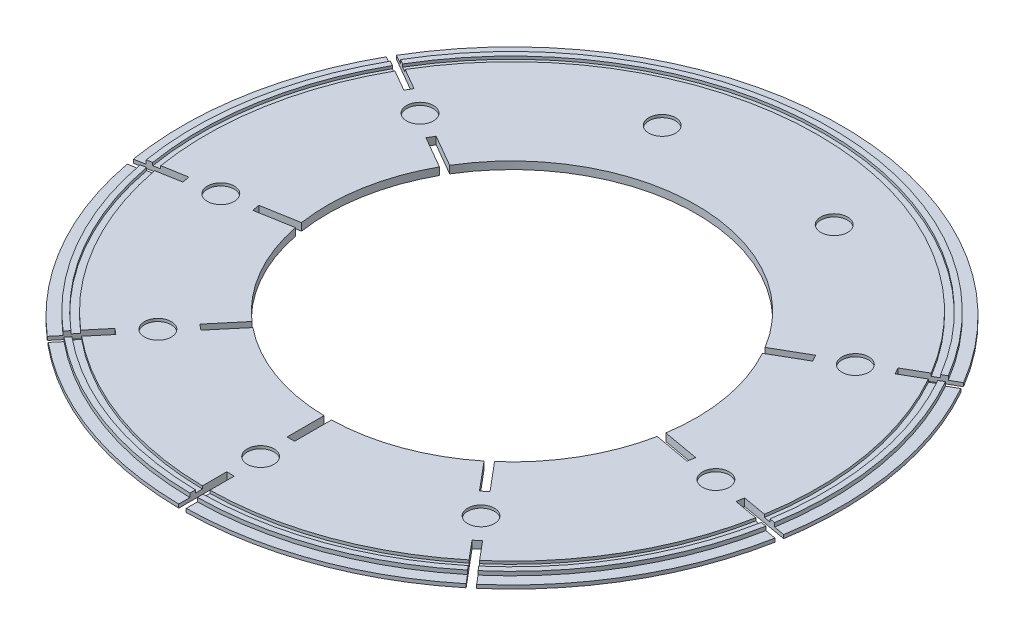
from build123d import *

# Parameters (mm, degrees)
SKETCH1_R           = 295
SKETCH1_R_2         = 165
BOSS_EXTRUDE1_DEPTH = 6.7
SKETCH2_W           = 6.7
SKETCH2_H           = 34
SKETCH2_H_2         = 44
CUT_EXTRUDE3_DEPTH  = 6.7
SKETCH3_R           = 280
SKETCH3_R_2         = 273.8
SKETCH3_R_3         = 12
CUT_EXTRUDE4_DEPTH  = 2.5
SKETCH5_R           = 296
SKETCH5_R_2         = 285
CUT_EXTRUDE5_DEPTH  = 3.5


with BuildPart() as part:
    # Sketch1 → Boss-Extrude1 (new body)
    with BuildSketch(Plane(origin=(0, 0, 0), x_dir=(1, 0, 0), z_dir=(0, 1, 0))):
        with Locations(Location((0, 0, 0), (0, 0, 270))):
            Circle(SKETCH1_R)
        with Locations(Location((0, 0, 0), (0, 0, 270))):
            Circle(SKETCH1_R_2, mode=Mode.SUBTRACT)
    extrude(amount=BOSS_EXTRUDE1_DEPTH)

    # Sketch2 → Cut-Extrude3 (cut)
    with BuildSketch(Plane(origin=(0, 6.7, 0), x_dir=(1, 0, 0), z_dir=(0, 1, 0))):
        Polygon((254.66851952, 150.901185103), (216.563401754, 128.901185103), (219.913401754, 123.098814897), (258.01851952, 145.098814897), align=None)
        Polygon((169.798029949, 101.901185103), (140.353166221, 84.901185103), (143.703166221, 79.098814897), (173.148029949, 96.098814897), align=None)
        Polygon((129.838195602, -149.523461245), (107.983416873, -123.477950179), (102.850919104, -127.784627164), (124.705697833, -153.83013823), align=None)
        Polygon((290.921373496, -54.698966562), (292.084816287, -48.100754617), (248.753275154, -40.460234799), (247.589832364, -47.058446745), align=None)
        Polygon((195.573656492, -31.083233205), (162.090192889, -25.179195165), (160.926750099, -31.77740711), (194.410213701, -37.681445151), align=None)
        Polygon((187.698883583, -228.902493656), (192.831381352, -224.595816671), (164.548726525, -190.889861174), (159.416228757, -195.196538158), align=None)
        with Locations((0, -181)):
            Rectangle(SKETCH2_W, SKETCH2_H)
        with Locations((0, -274)):
            Rectangle(SKETCH2_W, SKETCH2_H_2)
        Polygon((-124.705697833, -153.83013823), (-102.850919104, -127.784627164), (-107.983416873, -123.477950179), (-129.838195602, -149.523461245), align=None)
        Polygon((-192.831381352, -224.595816671), (-187.698883583, -228.902493656), (-159.416228757, -195.196538158), (-164.548726525, -190.889861174), align=None)
        Polygon((-194.410213701, -37.681445151), (-160.926750099, -31.77740711), (-162.090192889, -25.179195165), (-195.573656492, -31.083233205), align=None)
        Polygon((-292.084816287, -48.100754617), (-290.921373496, -54.698966562), (-247.589832364, -47.058446745), (-248.753275154, -40.460234799), align=None)
        Polygon((-254.66851952, 150.901185103), (-258.01851952, 145.098814897), (-219.913401754, 123.098814897), (-216.563401754, 128.901185103), align=None)
        Polygon((-173.148029949, 96.098814897), (-143.703166221, 79.098814897), (-140.353166221, 84.901185103), (-169.798029949, 101.901185103), align=None)
    extrude(amount=-CUT_EXTRUDE3_DEPTH, mode=Mode.SUBTRACT)

    # Sketch3 → Cut-Extrude4 (cut)
    # profile 1 of 10: a face of its own
    with BuildSketch(Plane(origin=(0, 6.7, 0), x_dir=(1, 0, 0), z_dir=(0, 1, 0))):
        Circle(SKETCH3_R)
        Circle(SKETCH3_R_2, mode=Mode.SUBTRACT)
    # profile 2 of 10: a face of its own
    with BuildSketch(Plane(origin=(0, 6.7, 0), x_dir=(1, 0, 0), z_dir=(0, 1, 0))):
        with Locations(Location((0, -225, 0), (0, 0, 270))):
            Circle(SKETCH3_R_3)
    # profile 3 of 10: a face of its own
    with BuildSketch(Plane(origin=(0, 6.7, 0), x_dir=(1, 0, 0), z_dir=(0, 1, 0))):
        with Locations(Location((-144.627212179, -172.359999702, 0), (0, 0, 270))):
            Circle(SKETCH3_R_3)
    # profile 4 of 10: a face of its own
    with BuildSketch(Plane(origin=(0, 6.7, 0), x_dir=(1, 0, 0), z_dir=(0, 1, 0))):
        with Locations(Location((-221.581744428, -39.070839975, 0), (0, 0, 270))):
            Circle(SKETCH3_R_3)
    # profile 5 of 10: a face of its own
    with BuildSketch(Plane(origin=(0, 6.7, 0), x_dir=(1, 0, 0), z_dir=(0, 1, 0))):
        with Locations(Location((-194.855715851, 112.5, 0), (0, 0, 270))):
            Circle(SKETCH3_R_3)
    # profile 6 of 10: a face of its own
    with BuildSketch(Plane(origin=(0, 6.7, 0), x_dir=(1, 0, 0), z_dir=(0, 1, 0))):
        with Locations(Location((-76.954532248, 211.430839677, 0), (0, 0, 270))):
            Circle(SKETCH3_R_3)
    # profile 7 of 10: a face of its own
    with BuildSketch(Plane(origin=(0, 6.7, 0), x_dir=(1, 0, 0), z_dir=(0, 1, 0))):
        with Locations(Location((76.954532248, 211.430839677, 0), (0, 0, 270))):
            Circle(SKETCH3_R_3)
    # profile 8 of 10: a face of its own
    with BuildSketch(Plane(origin=(0, 6.7, 0), x_dir=(1, 0, 0), z_dir=(0, 1, 0))):
        with Locations(Location((194.855715851, 112.5, 0), (0, 0, 270))):
            Circle(SKETCH3_R_3)
    # profile 9 of 10: a face of its own
    with BuildSketch(Plane(origin=(0, 6.7, 0), x_dir=(1, 0, 0), z_dir=(0, 1, 0))):
        with Locations(Location((221.581744428, -39.070839975, 0), (0, 0, 270))):
            Circle(SKETCH3_R_3)
    # profile 10 of 10: a face of its own
    with BuildSketch(Plane(origin=(0, 6.7, 0), x_dir=(1, 0, 0), z_dir=(0, 1, 0))):
        with Locations(Location((144.627212179, -172.359999702, 0), (0, 0, 270))):
            Circle(SKETCH3_R_3)
    extrude(amount=-CUT_EXTRUDE4_DEPTH, mode=Mode.SUBTRACT)

    # Sketch5 → Cut-Extrude5 (cut)
    with BuildSketch(Plane(origin=(0, 6.7, 0), x_dir=(1, 0, 0), z_dir=(0, 1, 0))):
        Circle(SKETCH5_R)
        Circle(SKETCH5_R_2, mode=Mode.SUBTRACT)
    extrude(amount=-CUT_EXTRUDE5_DEPTH, mode=Mode.SUBTRACT)


solid = part.part
